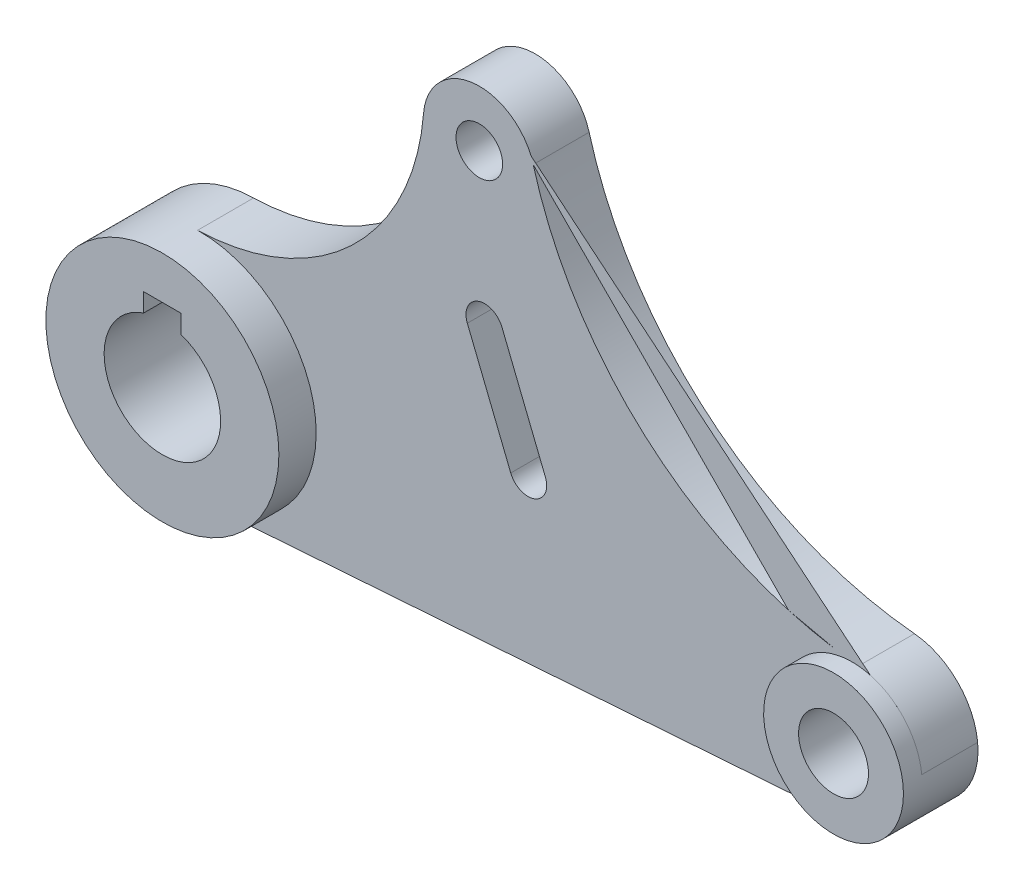
from build123d import *

# Parameters (mm, degrees)
EXTRUDE_1_DEPTH     = 12
SKETCH_2_R          = 25
EXTRUDE_2_DEPTH     = 20
SKETCH_3_R          = 15
EXTRUDE_3_DEPTH     = 16
SKETCH_4_R          = 12.5
CUT_EXTRUDE_1_DEPTH = 177.490810683
SKETCH_5_R          = 7.5
CUT_EXTRUDE_2_DEPTH = 177.490810683
SKETCH_6_R          = 5
CUT_EXTRUDE_3_DEPTH = 177.490810683
SKETCH_7_W          = 8
SKETCH_7_H          = 15.8
CUT_EXTRUDE_4_DEPTH = 177.490810683
CUT_EXTRUDE_5_DEPTH = 177.490810683


with BuildPart() as part:
    # 草图1 → 凸台-拉伸1 (new body)
    with BuildSketch(Plane.XY):
        with BuildLine():
            Line((1.78571, -24.93615), (141.071429, -14.96168))
            ThreePointArc((141.071429, -14.96168), (154.99926882, -0.14752424), (141.3656, 14.9378))
            ThreePointArc((141.3656, 14.9378), (97.38092577, 33.192499348), (71.563, 73.209))
            ThreePointArc((71.563, 73.209), (58.860086683, 81.945762749), (48.039, 70.964))
            ThreePointArc((48.039, 70.964), (32.544866926, 38.640642001), (-0.6, 24.992))
            ThreePointArc((-0.6, 24.992), (-24.970691707, -1.193574475), (1.78571, -24.93615))
        make_face()
    extrude(amount=EXTRUDE_1_DEPTH)

    # 草图2 → 凸台-拉伸2 (add)
    with BuildSketch(Plane.XY):
        with Locations(Location((0, 0, 0), (0, 0, 91.002589643))):
            Circle(SKETCH_2_R)
    extrude(amount=EXTRUDE_2_DEPTH)

    # 草图3 → 凸台-拉伸3 (add)
    with BuildSketch(Plane.XY):
        with Locations(Location((140, 0, 0), (0, 0, 274.096046963))):
            Circle(SKETCH_3_R)
    extrude(amount=EXTRUDE_3_DEPTH)

    # 草图4 → 切除-拉伸1 (cut, through all)
    with BuildSketch(Plane.XY):
        Circle(SKETCH_4_R)
    extrude(amount=CUT_EXTRUDE_1_DEPTH, mode=Mode.SUBTRACT)

    # 草图5 → 切除-拉伸2 (cut, through all)
    with BuildSketch(Plane.XY):
        with Locations((140, 0)):
            Circle(SKETCH_5_R)
    extrude(amount=CUT_EXTRUDE_2_DEPTH, mode=Mode.SUBTRACT)

    # 草图6 → 切除-拉伸3 (cut, through all)
    with BuildSketch(Plane.XY):
        with Locations((60, 70)):
            Circle(SKETCH_6_R)
    extrude(amount=CUT_EXTRUDE_3_DEPTH, mode=Mode.SUBTRACT)

    # 草图7 → 切除-拉伸4 (cut, through all)
    with BuildSketch(Plane.XY):
        with Locations((0, 7.9)):
            Rectangle(SKETCH_7_W, SKETCH_7_H)
    extrude(amount=CUT_EXTRUDE_4_DEPTH, mode=Mode.SUBTRACT)

    # 草图8 → 切除-拉伸5 (cut, through all)
    with BuildSketch(Plane.XY):
        with BuildLine():
            Line((74.168550964, 16.468787549), (64.853850964, 39.644587549))
            ThreePointArc((64.853850964, 39.644587549), (59.650712451, 41.864350964), (57.430949036, 36.661212451))
            Line((57.430949036, 36.661212451), (66.745649036, 13.485412451))
            ThreePointArc((66.745649036, 13.485412451), (71.948787549, 11.265649036), (74.168550964, 16.468787549))
        make_face()
    extrude(amount=CUT_EXTRUDE_5_DEPTH, mode=Mode.SUBTRACT)


solid = part.part
